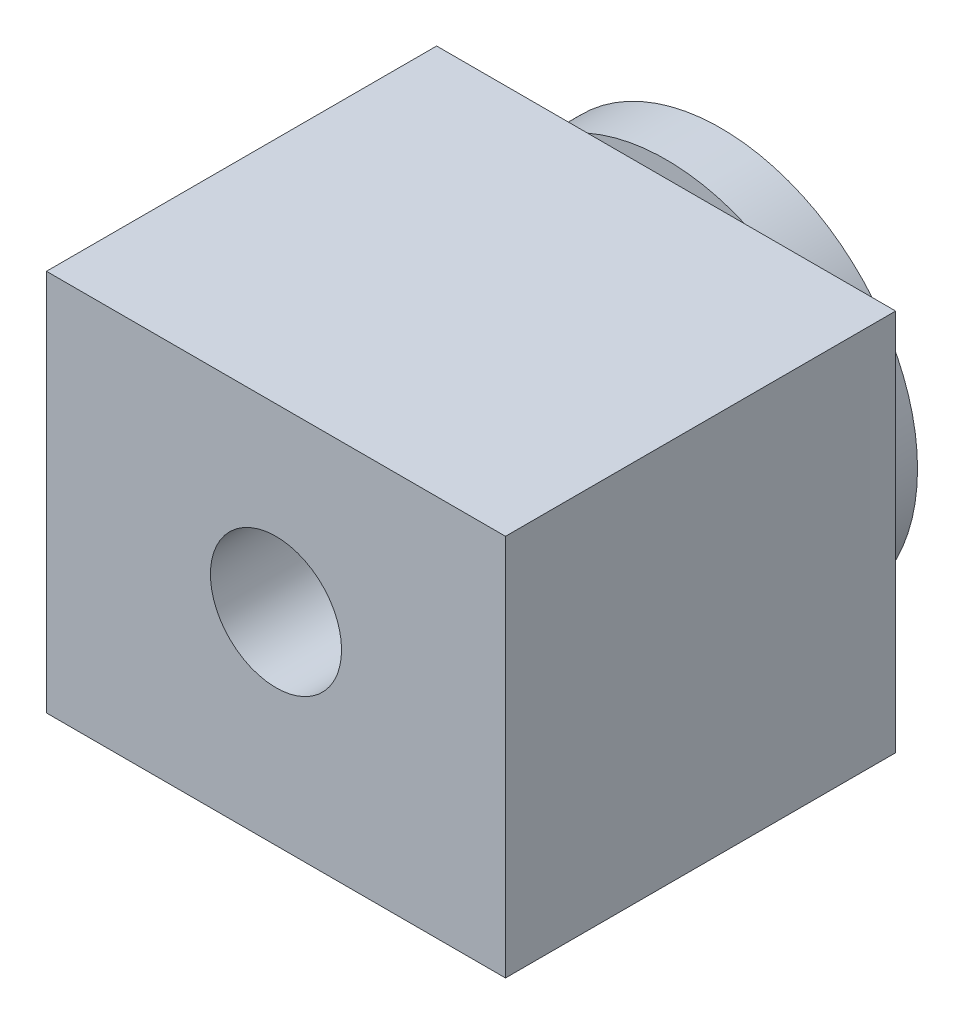
from build123d import *

# Parameters (mm, degrees)
SKETCH_1_R      = 18
SKETCH_1_R_2    = 6
EXTRUDE_1_DEPTH = 5
SKETCH_2_W      = 42
SKETCH_2_H      = 35
SKETCH_2_R      = 6
EXTRUDE_2_DEPTH = 35.7


with BuildPart() as part:
    # 草图1 → 凸台-拉伸1 (new body)
    with BuildSketch(Plane.XY):
        Circle(SKETCH_1_R)
        Circle(SKETCH_1_R_2, mode=Mode.SUBTRACT)
    extrude(amount=EXTRUDE_1_DEPTH)

    # 草图2 → 凸台-拉伸2 (add)
    with BuildSketch(Plane.XY.offset(5)):
        with Locations((0, -1)):
            Rectangle(SKETCH_2_W, SKETCH_2_H)
        Circle(SKETCH_2_R, mode=Mode.SUBTRACT)
    extrude(amount=EXTRUDE_2_DEPTH)


solid = part.part
